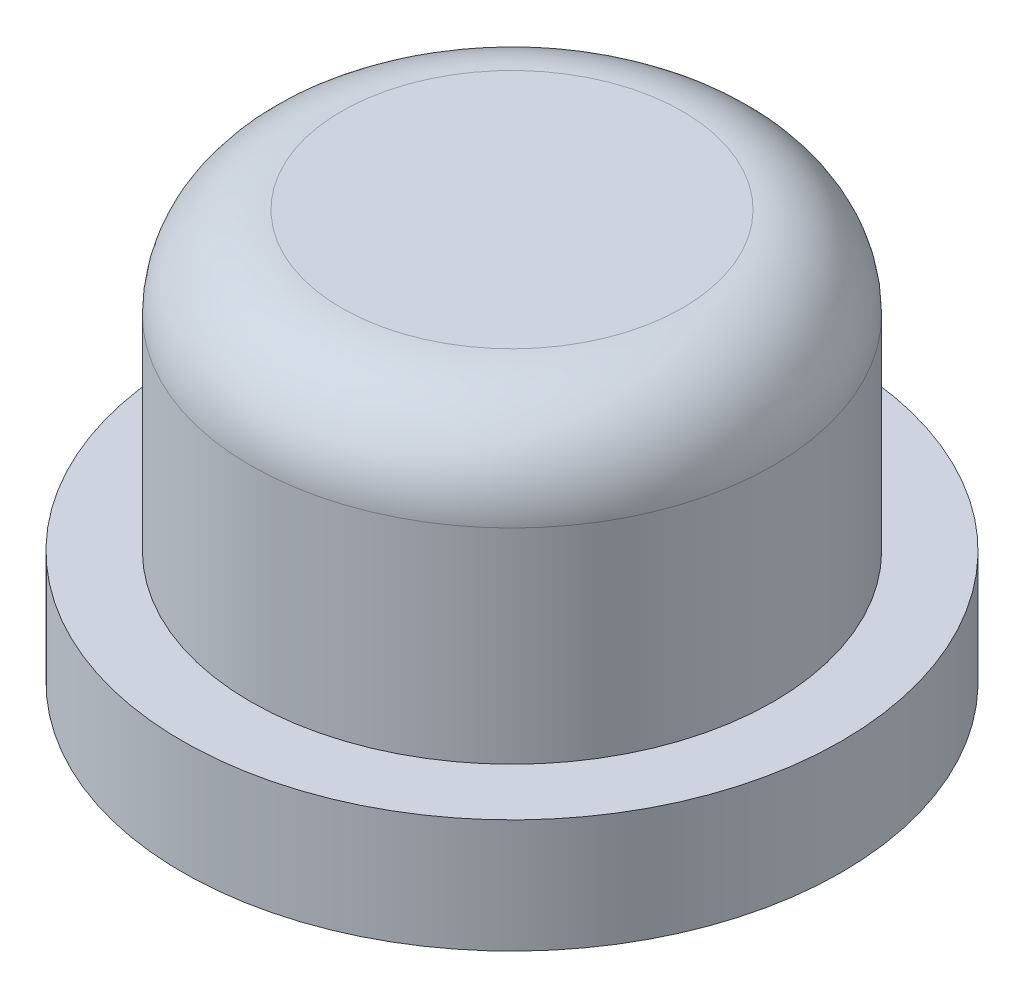
from build123d import *

# Parameters (mm, degrees)
SKETCH_5_R          = 1.8
CUT_EXTRUDE_1_DEPTH = 2.2


with BuildPart() as part:
    # 草图2 → 旋转1 (revolve)
    with BuildSketch(Plane.XY.offset(-3.85000283)):
        with BuildLine():
            Line((1.5, 3.6), (0, 3.6))
            Line((0, 3.6), (0, 0))
            Line((0, 0), (2.9, 0))
            Line((2.9, 0), (2.9, 1))
            Line((2.9, 1), (2.3, 1))
            Line((2.3, 1), (2.3, 2.8))
            ThreePointArc((2.3, 2.8), (2.065685425, 3.365685425), (1.5, 3.6))
        make_face()
    revolve(axis=Axis((0, 3.6, -3.85000283), (0, -1, 0)))

    # 草图5 → 切除-拉伸1 (cut)
    with BuildSketch(Plane.XZ):
        with Locations((0, -3.85000283)):
            Circle(SKETCH_5_R)
    extrude(amount=-CUT_EXTRUDE_1_DEPTH, mode=Mode.SUBTRACT)


solid = part.part
